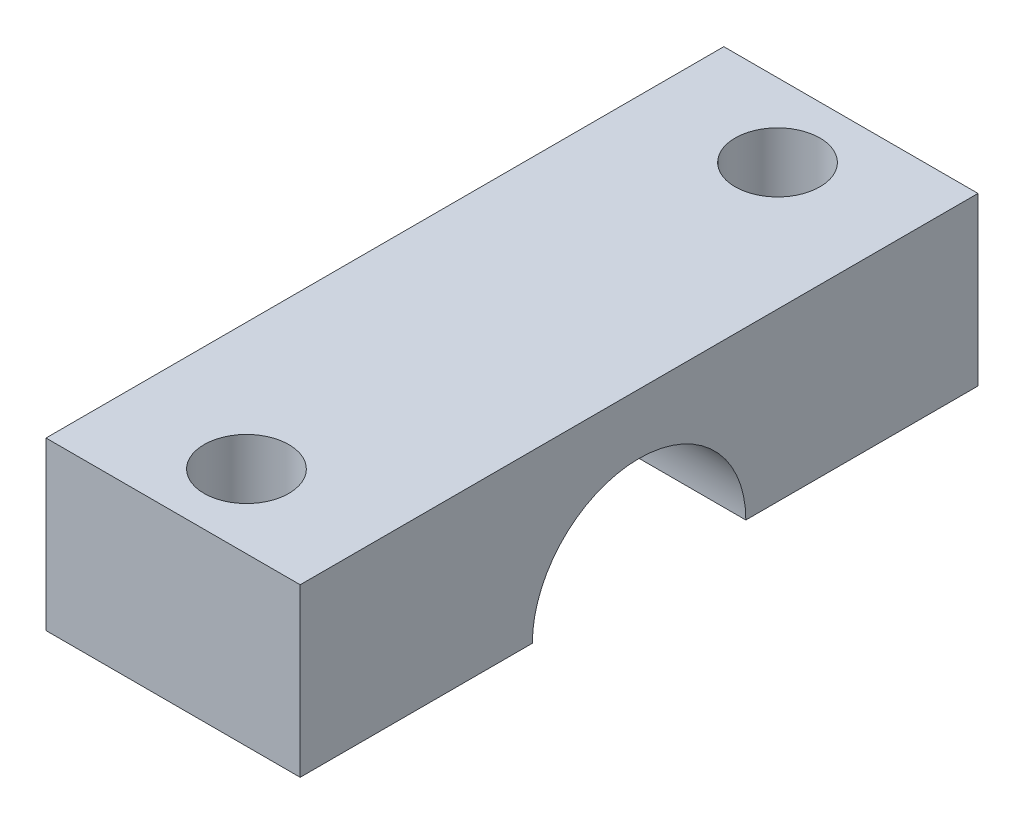
from build123d import *

# Parameters (mm, degrees)
BOSS_EXTRUDE1_DEPTH = 9.525
SKETCH2_R           = 1.5875
CUT_EXTRUDE1_DEPTH  = 18.06101184


with BuildPart() as part:
    # Sketch1 → Boss-Extrude1 (new body)
    with BuildSketch(Plane(origin=(0, 0, 0), x_dir=(0, 0, -1), z_dir=(1, 0, 0))):
        with BuildLine():
            Line((-4, 0), (-12.7, 0))
            Line((-12.7, 0), (-12.7, 6.25))
            Line((-12.7, 6.25), (12.7, 6.25))
            Line((12.7, 6.25), (12.7, 0))
            Line((12.7, 0), (4, 0))
            ThreePointArc((4, 0), (0, 4), (-4, 0))
        make_face()
    extrude(amount=BOSS_EXTRUDE1_DEPTH)

    # Sketch2 → Cut-Extrude1 (cut, through all)
    with BuildSketch(Plane(origin=(0, 6.25, 0), x_dir=(1, 0, 0), z_dir=(0, 1, 0))):
        with Locations(Location((4.7625, -9.95, 0), (0, 0, 270))):
            Circle(SKETCH2_R)
        with Locations(Location((4.7625, 9.95, 0), (0, 0, 270))):
            Circle(SKETCH2_R)
    extrude(amount=-CUT_EXTRUDE1_DEPTH, mode=Mode.SUBTRACT)


solid = part.part
